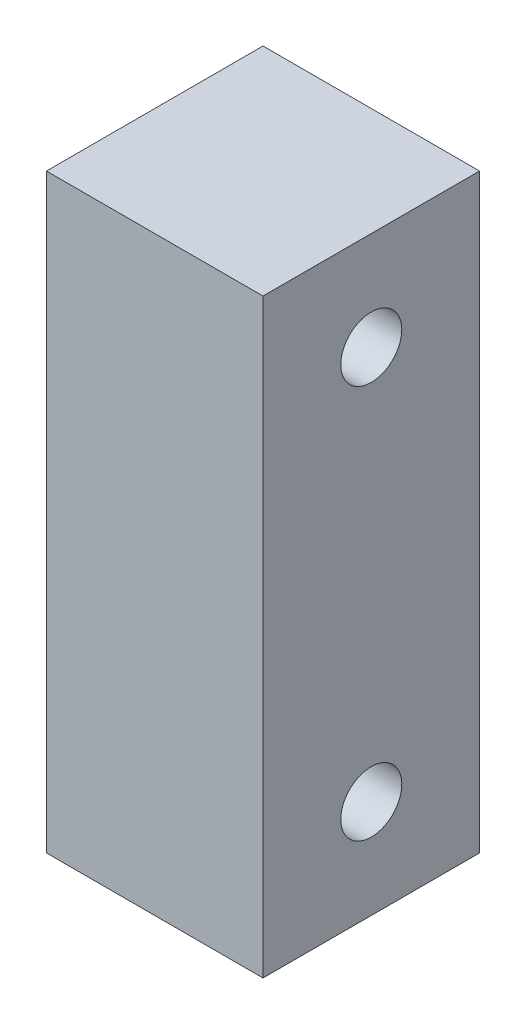
from build123d import *

# Parameters (mm, degrees)
SKETCH1_W           = 13.97
SKETCH1_H           = 38.1
BOSS_EXTRUDE1_DEPTH = 13.97
SKETCH2_R           = 1.9685
CUT_EXTRUDE2_DEPTH  = 13.97


with BuildPart() as part:
    # Sketch1 → Boss-Extrude1 (new body)
    with BuildSketch(Plane.XY):
        with Locations((-37.077191011, -17.498671499)):
            Rectangle(SKETCH1_W, SKETCH1_H)
    extrude(amount=BOSS_EXTRUDE1_DEPTH)

    # Sketch2 → Cut-Extrude2 (cut)
    with BuildSketch(Plane.ZY.offset(44.062191011)):
        with Locations((6.985, -4.798671499)):
            Circle(SKETCH2_R)
        with Locations((6.985, -30.198671499)):
            Circle(SKETCH2_R)
    extrude(amount=-CUT_EXTRUDE2_DEPTH, mode=Mode.SUBTRACT)


solid = part.part
